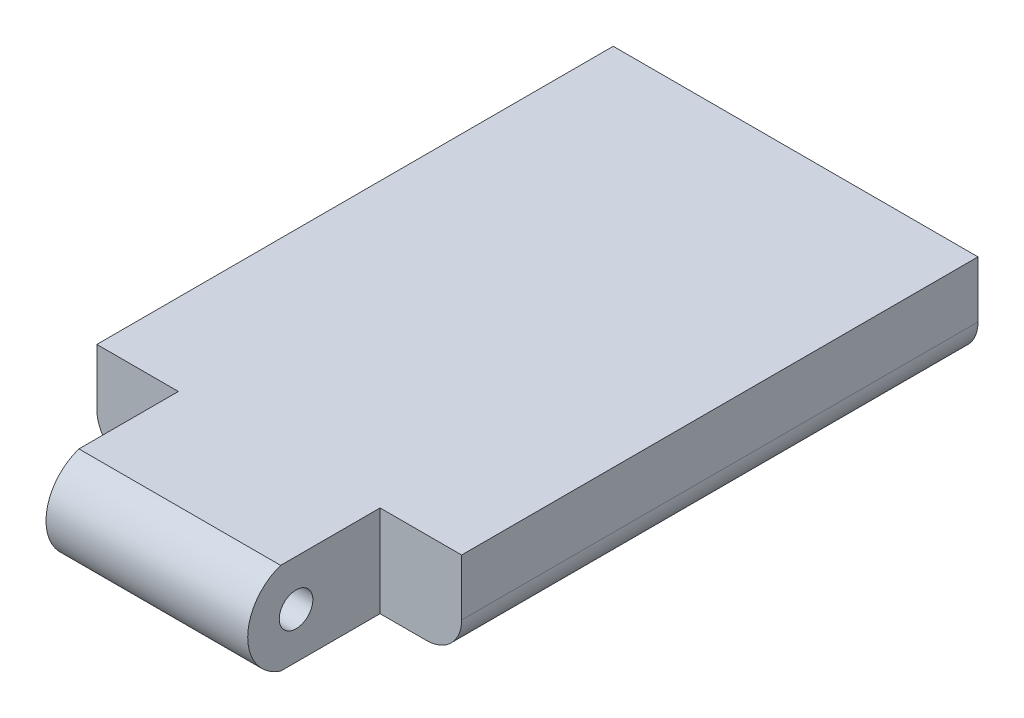
from build123d import *

# Parameters (mm, degrees)
BOSS_EXTRUDE1_START = -46.439051
BOSS_EXTRUDE1_DEPTH = 61.439051
SKETCH2_W           = 24
SKETCH2_H           = 11.5
BOSS_EXTRUDE2_DEPTH = 10
BOSS_EXTRUDE3_START = -24
BOSS_EXTRUDE3_DEPTH = 24
SKETCH4_R           = 2
CUT_EXTRUDE1_DEPTH  = 24
CUT_EXTRUDE2_START  = -73.272081
CUT_EXTRUDE2_DEPTH  = 73.272081


with BuildPart() as part:
    # Sketch1 → Boss-Extrude1 (new body)
    with BuildSketch(Plane.XY.offset(BOSS_EXTRUDE1_START)):
        with BuildLine():
            Line((-17.5, 16.5), (-22, 16.5))
            Line((-22, 16.5), (-22, 9.5))
            ThreePointArc((-22, 9.5), (-20.681980515, 6.318019485), (-17.5, 5))
            Line((-17.5, 5), (17.5, 5))
            ThreePointArc((17.5, 5), (20.681980515, 6.318019485), (22, 9.5))
            Line((22, 9.5), (22, 16.5))
            Line((22, 16.5), (-17.5, 16.5))
        make_face()
    extrude(amount=BOSS_EXTRUDE1_DEPTH)

    # Sketch2 → Boss-Extrude2 (add)
    with BuildSketch(Plane.XY.offset(15)):
        with Locations((0, 10.75)):
            Rectangle(SKETCH2_W, SKETCH2_H)
    extrude(amount=BOSS_EXTRUDE2_DEPTH)

    # Sketch3 → Boss-Extrude3 (add)
    with BuildSketch(Plane(origin=(12, 0, 0), x_dir=(0, 0, -1), z_dir=(1, 0, 0)).offset(BOSS_EXTRUDE3_START)):
        with BuildLine():
            Line((-25, 5), (-25, 16.5))
            ThreePointArc((-25, 16.5), (-30.75, 10.75), (-25, 5))
        make_face()
    extrude(amount=BOSS_EXTRUDE3_DEPTH)

    # Sketch4 → Cut-Extrude1 (cut)
    with BuildSketch(Plane(origin=(12, 0, 0), x_dir=(0, 0, -1), z_dir=(1, 0, 0))):
        with Locations(Location((-25, 10.75, 0), (0, 0, 90))):
            Circle(SKETCH4_R)
    extrude(amount=-CUT_EXTRUDE1_DEPTH, mode=Mode.SUBTRACT)

    # Sketch5 → Cut-Extrude2 (cut)
    with BuildSketch(Plane(origin=(0, 0, -46.439050788), x_dir=(-1, 0, 0), z_dir=(0, 0, -1)).offset(CUT_EXTRUDE2_START)):
        with BuildLine():
            Line((22, 16.5), (-22, 16.5))
            Line((-22, 16.5), (-22, 9.5))
            ThreePointArc((-22, 9.5), (-20.681980515, 6.318019485), (-17.5, 5))
            Line((-17.5, 5), (17.5, 5))
            ThreePointArc((17.5, 5), (20.681980515, 6.318019485), (22, 9.5))
            Line((22, 9.5), (22, 16.5))
        make_face()
        with BuildLine():
            Line((21.7, 16.2), (-21.7, 16.2))
            Line((-21.7, 16.2), (-21.7, 9.5))
            ThreePointArc((-21.7, 9.5), (-20.469848481, 6.530151519), (-17.5, 5.3))
            Line((-17.5, 5.3), (17.5, 5.3))
            ThreePointArc((17.5, 5.3), (20.469848481, 6.530151519), (21.7, 9.5))
            Line((21.7, 9.5), (21.7, 16.2))
        make_face(mode=Mode.SUBTRACT)
    extrude(amount=CUT_EXTRUDE2_DEPTH, mode=Mode.SUBTRACT)


solid = part.part
